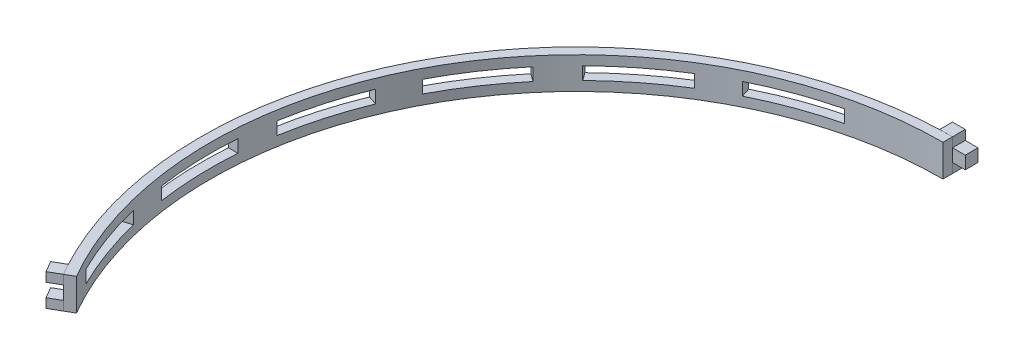
from build123d import *

# Parameters (mm, degrees)
BOSS_EXTRUDE1_DEPTH             = 10
BOSS_EXTRUDE1_2_DEPTH           = 10
BOSS_EXTRUDE1_3_DEPTH           = 10
SKETCH2_W                       = 8
SKETCH2_H                       = 4.2
CUT_EXTRUDE1_DEPTH              = 4
SKETCH3_W                       = 8
SKETCH3_H                       = 4
BOSS_EXTRUDE2_DEPTH             = 4
SKETCH4_W                       = 25
SKETCH4_H                       = 4
CUT_EXTRUDE2_DEPTH              = 171.023527784
CIRPATTERN4_COUNT               = 5
CIRPATTERN4_ANGLE               = 72
CIRPATTERN4_THE_OTHER_WAY_COUNT = 5
CIRPATTERN4_THE_OTHER_WAY_ANGLE = 72


with BuildPart() as part:
    # Sketch1 → Boss-Extrude1 (new body)
    with BuildSketch(Plane(origin=(0, 0, 0), x_dir=(1, 0, 0), z_dir=(0, 1, 0))):
        with BuildLine():
            Line((0, 115), (0, 118))
            Line((0, 118), (-4, 117.932183902))
            ThreePointArc((-4, 117.932183902), (-102.190997647, 59), (-104.132267183, -55.501990336))
            Line((-104.132267183, -55.501990336), (-102.190997647, -59))
            Line((-102.190997647, -59), (-99.592921435, -57.5))
            ThreePointArc((-99.592921435, -57.5), (-99.592921435, 57.5), (0, 115))
        make_face()
    extrude(amount=BOSS_EXTRUDE1_DEPTH)



with BuildPart() as body_2:
    # Sketch1 → Boss-Extrude1 2 (new body)
    with BuildSketch(Plane(origin=(0, 0, 0), x_dir=(1, 0, 0), z_dir=(0, 1, 0))):
        with BuildLine():
            ThreePointArc((-4, 117.932183902), (-2.000287418, 117.983044757), (0, 118))
            Line((0, 118), (0, 122))
            Line((0, 122), (-4, 122))
            Line((-4, 122), (-4, 117.932183902))
        make_face()
    extrude(amount=BOSS_EXTRUDE1_2_DEPTH)


with BuildPart() as body_3:
    # Sketch1 → Boss-Extrude1 3 (new body)
    with BuildSketch(Plane(origin=(0, 0, 0), x_dir=(1, 0, 0), z_dir=(0, 1, 0))):
        with BuildLine():
            ThreePointArc((-102.190997647, -59), (-103.176457685, -57.25922266), (-104.132267183, -55.501990336))
            Line((-104.132267183, -55.501990336), (-107.655099262, -57.535898385))
            Line((-107.655099262, -57.535898385), (-105.655099262, -61))
            Line((-105.655099262, -61), (-102.190997647, -59))
        make_face()
    extrude(amount=BOSS_EXTRUDE1_3_DEPTH)

    # Sketch2 → Cut-Extrude1 (cut)
    with BuildSketch(Plane(origin=(-105.655099262, 0, 61), x_dir=(0.5000000000000009, 0, 0.8660254037844382), z_dir=(-0.8660254037844382, 0, 0.5000000000000009))):
        with Locations((0, 5)):
            Rectangle(SKETCH2_W, SKETCH2_H)
    extrude(amount=-CUT_EXTRUDE1_DEPTH, mode=Mode.SUBTRACT)


with BuildPart() as part_1:
    add(part.part)

    add(body_2.part)  # Boss-Extrude2 merges body 2
    # Sketch3 → Boss-Extrude2 (add)
    with BuildSketch(Plane(origin=(0, 0, -122), x_dir=(-1, 0, 0), z_dir=(0, 0, -1))):
        with Locations((0, 5)):
            Rectangle(SKETCH3_W, SKETCH3_H)
    extrude(amount=-BOSS_EXTRUDE2_DEPTH)

    # Sketch4 → Cut-Extrude2 (cut, through all)
    with BuildSketch(Plane(origin=(0, 0, 0), x_dir=(0, 0, -1), z_dir=(1, 0, 0))):
        with Locations((-4.172320837, 5)):
            Rectangle(SKETCH4_W, SKETCH4_H)
    cut_extrude2 = extrude(amount=-CUT_EXTRUDE2_DEPTH, mode=Mode.SUBTRACT)

    # CirPattern4: Cut-Extrude2 ×5 about axis
    cirpattern4_axis = Axis((0, 0, 0), (0, -1, 0))
    for i in range(1, CIRPATTERN4_COUNT):
        add(cut_extrude2.rotate(cirpattern4_axis, i * CIRPATTERN4_ANGLE / (CIRPATTERN4_COUNT - 1)), mode=Mode.SUBTRACT)

    # CirPattern4 the other way: Cut-Extrude2 ×5 about axis
    cirpattern4_the_other_way_axis = Axis((0, 0, 0), (0, 1, 0))
    for i in range(1, CIRPATTERN4_THE_OTHER_WAY_COUNT):
        add(cut_extrude2.rotate(cirpattern4_the_other_way_axis, i * CIRPATTERN4_THE_OTHER_WAY_ANGLE / (CIRPATTERN4_THE_OTHER_WAY_COUNT - 1)), mode=Mode.SUBTRACT)


solid = Compound([body_3.part, part_1.part])
